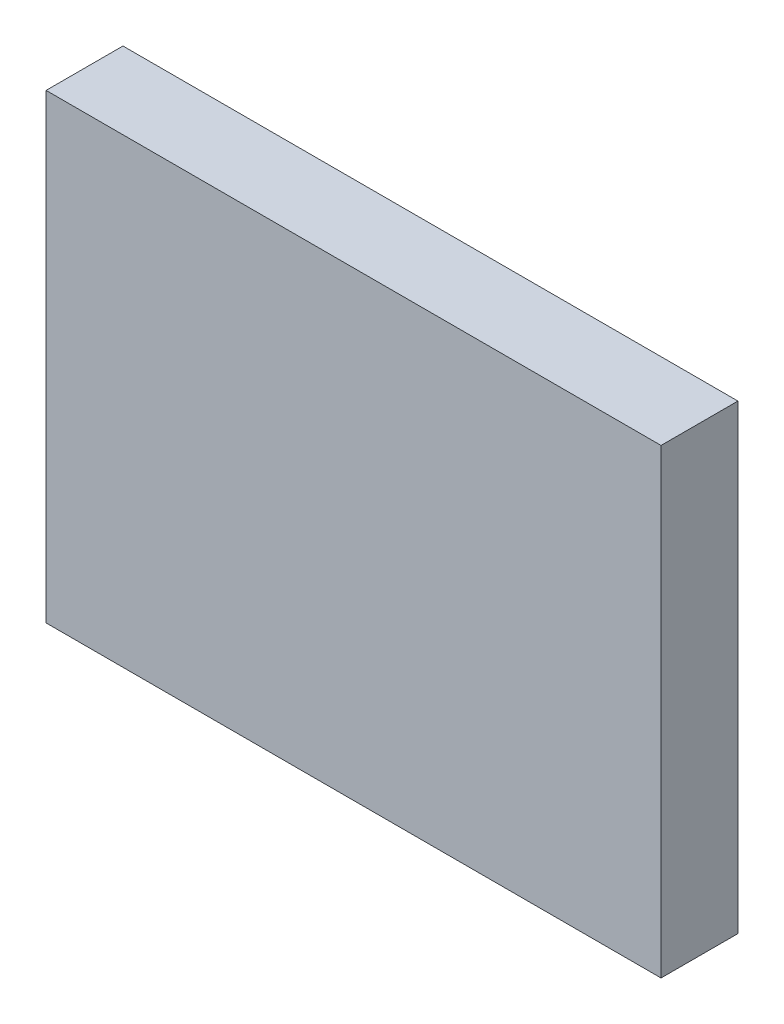
from build123d import *

# Parameters (mm, degrees)
SKETCH_2_W      = 80
SKETCH_2_H      = 60
EXTRUDE_1_DEPTH = 10


with BuildPart() as part:
    # 草图2 → 凸台-拉伸1 (new body)
    with BuildSketch(Plane.XY):
        with Locations((40, -30)):
            Rectangle(SKETCH_2_W, SKETCH_2_H)
    extrude(amount=EXTRUDE_1_DEPTH)


solid = part.part
